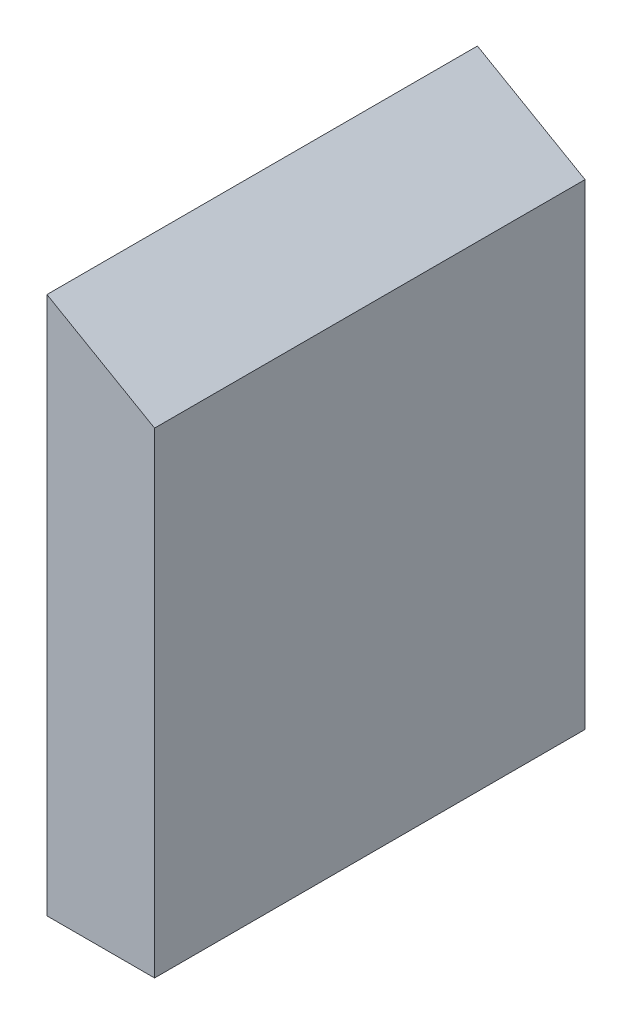
from build123d import *

# Parameters (mm, degrees)
BOSS_EXTRUDE1_DEPTH = 40


with BuildPart() as part:
    # Sketch1 → Boss-Extrude1 (new body)
    with BuildSketch(Plane.XY):
        Polygon((0, 0), (0, 50), (10, 44.25), (10, 0), align=None)
    extrude(amount=BOSS_EXTRUDE1_DEPTH)


solid = part.part
